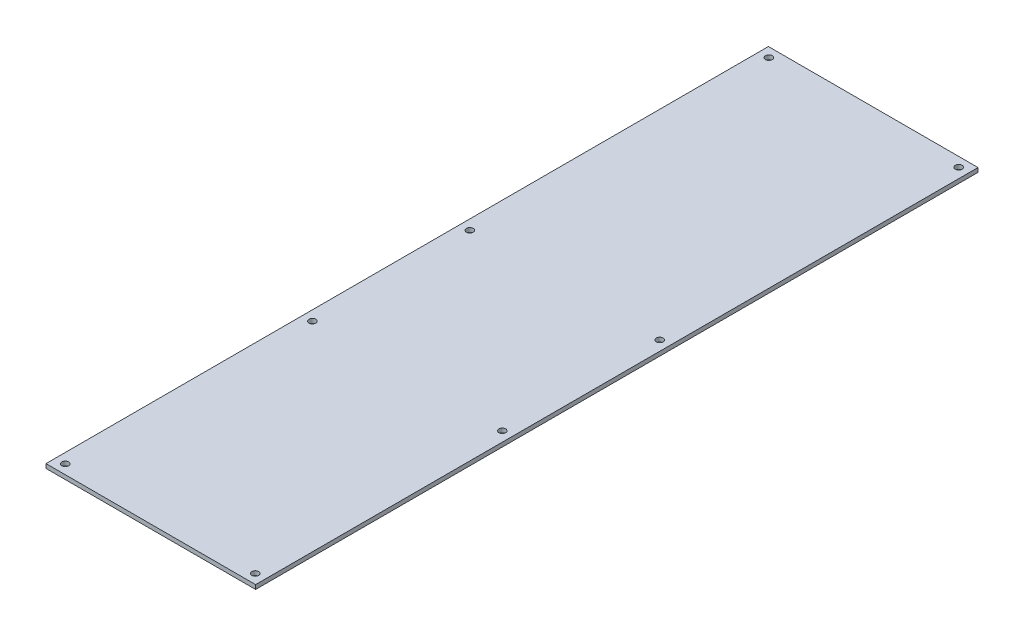
from build123d import *

# Parameters (mm, degrees)
SKETCH1_W              = 89.225
SKETCH1_H              = 307.5
BOSS_EXTRUDE1_DEPTH    = 1.8
M2_5_CLEARANCE_HOLE1_D = 2.9


with BuildPart() as part:
    # Sketch1 → Boss-Extrude1 (new body)
    with BuildSketch(Plane(origin=(0, 0, 0), x_dir=(1, 0, 0), z_dir=(0, 1, 0))):
        with Locations((44.6125, -153.75)):
            Rectangle(SKETCH1_W, SKETCH1_H)
    extrude(amount=BOSS_EXTRUDE1_DEPTH)

    # M2.5 Clearance Hole1 (through all)
    with Locations(Plane(origin=(0, 1.8, 0), x_dir=(1, 0, 0), z_dir=(0, 1, 0))):
        with Locations((4.2, -4), (85.025, -4), (85.025, -131.3), (85.025, -198.3), (85.025, -303.5), (4.2, -303.5), (4.2, -198.3), (4.2, -131.3)):
            Hole(M2_5_CLEARANCE_HOLE1_D / 2)


solid = part.part
